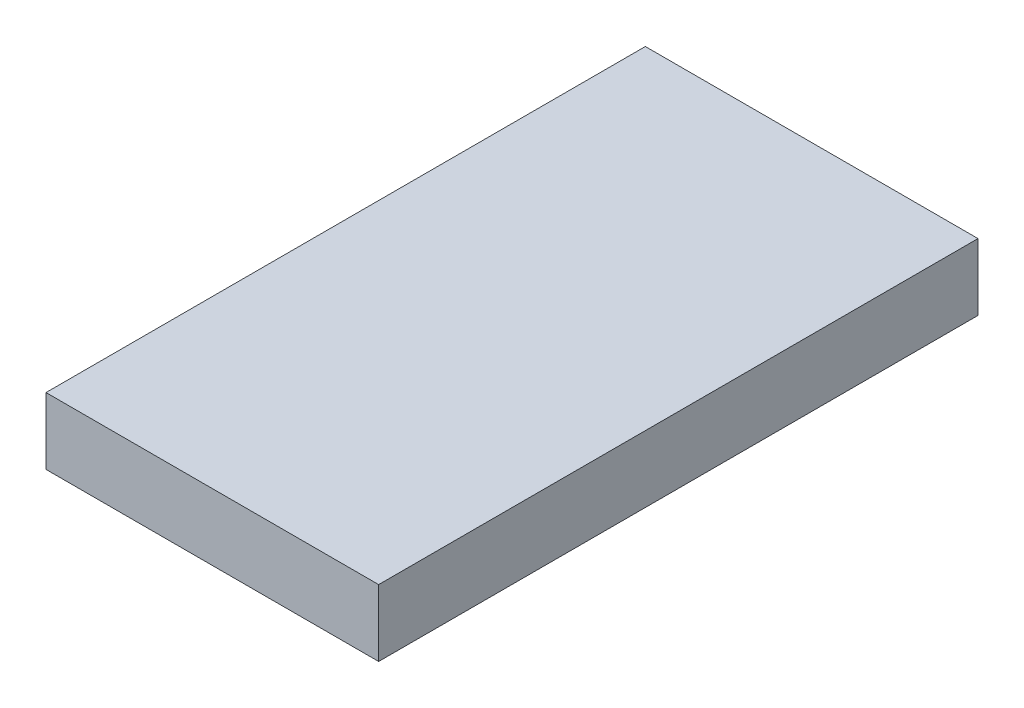
from build123d import *

# Parameters (mm, degrees)
SKETCH1_W           = 126.87554
SKETCH1_H           = 25.4
BOSS_EXTRUDE1_DEPTH = 228.6


with BuildPart() as part:
    # Sketch1 → Boss-Extrude1 (new body)
    with BuildSketch(Plane.XY):
        Rectangle(SKETCH1_W, SKETCH1_H)
    extrude(amount=BOSS_EXTRUDE1_DEPTH)


solid = part.part
